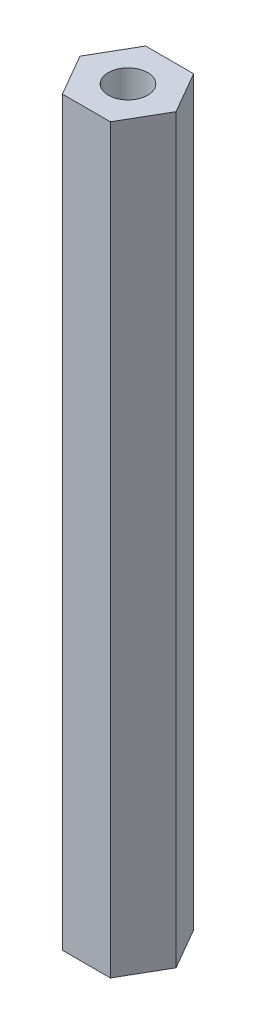
from build123d import *

# Parameters (mm, degrees)
BOSS_EXTRU_1_DEPTH      = 24.5
BOSS_EXTRU_1_DEPTH_BACK = 24.5


with BuildPart() as part:
    # Esquisse1 → Boss.-Extru.1 (new, two sides: drawn at the far end of the back side and taken through both)
    with BuildSketch(Plane(origin=(0, 0, 0), x_dir=(1, 0, 0), z_dir=(0, 1, 0)).offset(-BOSS_EXTRU_1_DEPTH_BACK)):
        Polygon((3.175426481, 0), (1.58771324, 2.75), (-1.58771324, 2.75), (-3.175426481, 0), (-1.58771324, -2.75), (1.58771324, -2.75), align=None)
    extrude(amount=BOSS_EXTRU_1_DEPTH + BOSS_EXTRU_1_DEPTH_BACK)

    # Esquisse3 → Dégagement M31 (revolve, cut)
    with BuildSketch(Plane(origin=(0, 24.5, 0), x_dir=(0, 0, 1), z_dir=(1, 0, 0))):
        Polygon((0, 0), (0, 7.131118805), (1.3, 6.35), (1.3, 0), align=None)
    d_gagement_m31 = revolve(axis=Axis((0, 30.85, 0), (0, -1, 0)), mode=Mode.SUBTRACT)

    # Symétrie1: Dégagement M31 across plane
    add(d_gagement_m31.mirror(Plane.ZX), mode=Mode.SUBTRACT)


solid = part.part
